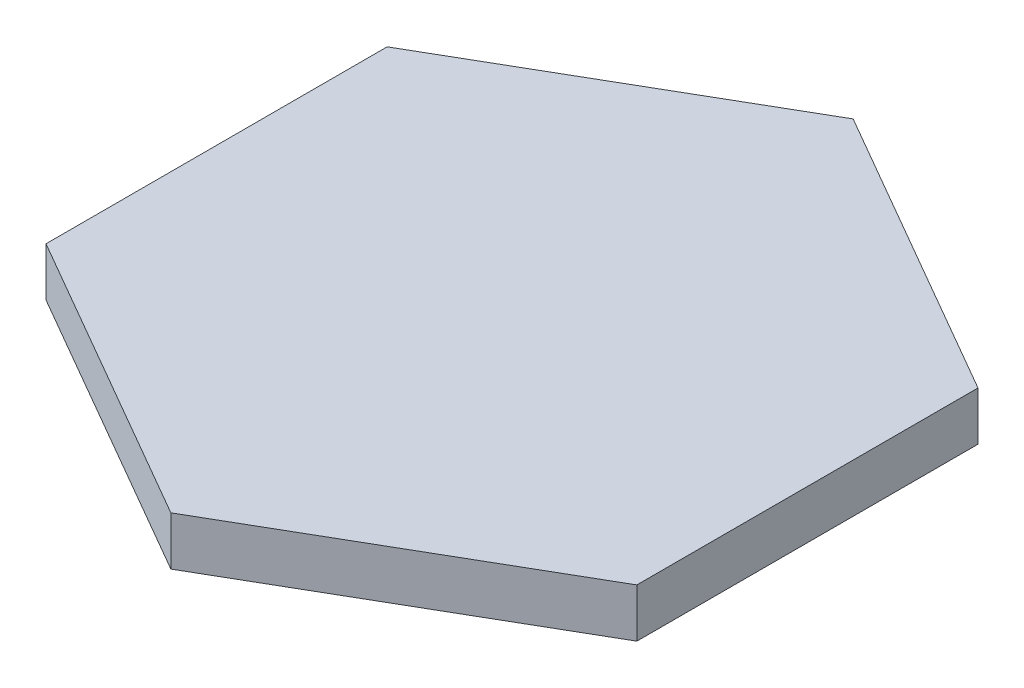
from build123d import *

# Parameters (mm, degrees)
BOSS_EXTRUDE1_DEPTH = 12.7


with BuildPart() as part:
    # Sketch1 → Boss-Extrude1 (new body)
    with BuildSketch(Plane(origin=(0, 0, 0), x_dir=(1, 0, 0), z_dir=(0, 1, 0))):
        Polygon((0, 88.9), (-76.989658396, 44.45), (-76.989658396, -44.45), (0, -88.9), (76.989658396, -44.45), (76.989658396, 44.45), align=None)
    extrude(amount=BOSS_EXTRUDE1_DEPTH)


solid = part.part
